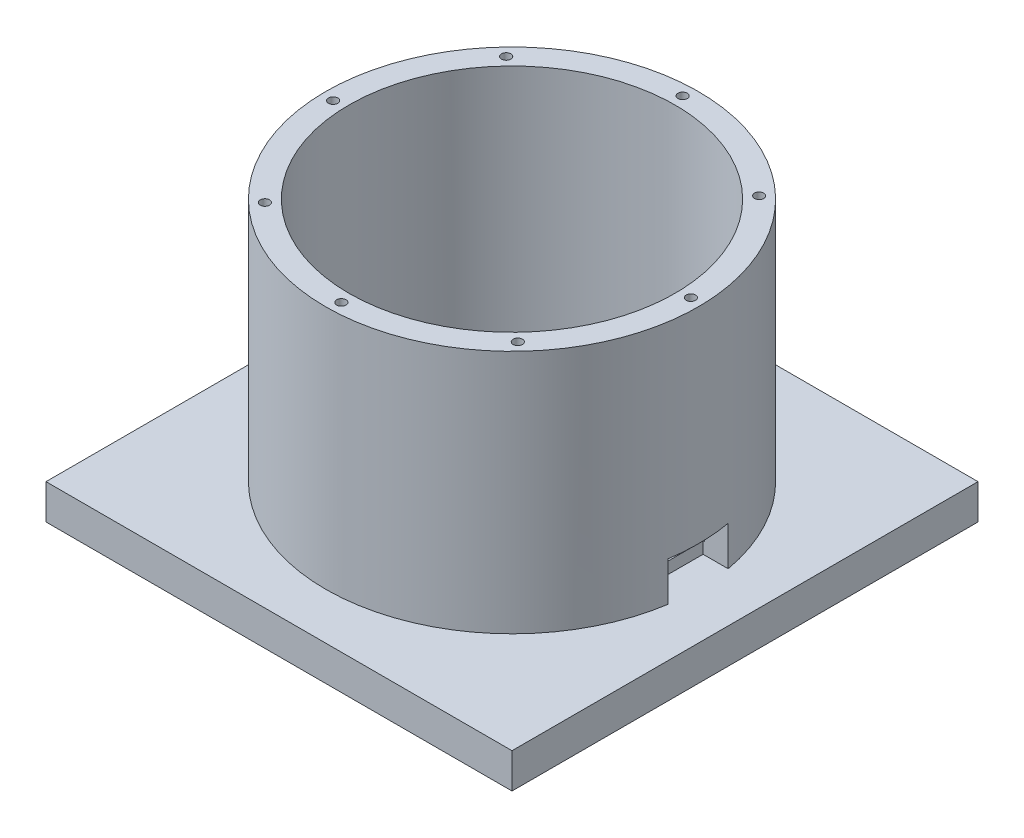
from build123d import *

# Parameters (mm, degrees)
CROQUIS1_R              = 80
SALIENTE_EXTRUIR1_DEPTH = 5
CROQUIS2_R              = 80
CROQUIS2_R_2            = 70
SALIENTE_EXTRUIR2_DEPTH = 100
CROQUIS3_R              = 16.15
CROQUIS3_R_2            = 12.15
CROQUIS3_R_3            = 17.65
CROQUIS3_R_4            = 12.65
SALIENTE_EXTRUIR3_DEPTH = 8
SALIENTE_EXTRUIR4_DEPTH = 50
CROQUIS6_W              = 200
CROQUIS6_H              = 200
SALIENTE_EXTRUIR5_DEPTH = 15
CROQUIS8_W              = 26.192306131
CROQUIS8_H              = 16.90838964
CORTAR_EXTRUIR1_DEPTH   = 32
CROQUIS9_R              = 2
CORTAR_EXTRUIR2_DEPTH   = 10


with BuildPart() as part:
    # Croquis1 → Saliente-Extruir1 (new body)
    with BuildSketch(Plane(origin=(0, 0, 0), x_dir=(1, 0, 0), z_dir=(0, 1, 0))):
        with Locations(Location((0, 0, 0), (0, 0, 270))):
            Circle(CROQUIS1_R)
    extrude(amount=SALIENTE_EXTRUIR1_DEPTH)

    # Croquis2 → Saliente-Extruir2 (add)
    with BuildSketch(Plane(origin=(0, 5, 0), x_dir=(1, 0, 0), z_dir=(0, 1, 0))):
        with Locations(Location((0, 0, 0), (0, 0, 270))):
            Circle(CROQUIS2_R)
        with Locations(Location((0, 0, 0), (0, 0, 270))):
            Circle(CROQUIS2_R_2, mode=Mode.SUBTRACT)
    extrude(amount=SALIENTE_EXTRUIR2_DEPTH)

    # Croquis3 → Saliente-Extruir3 (add)
    # profile 1 of 2: a face of its own
    with BuildSketch(Plane(origin=(0, 5, 0), x_dir=(1, 0, 0), z_dir=(0, 1, 0))):
        with Locations(Location((0, 0, 0), (0, 0, 270))):
            Circle(CROQUIS3_R)
        with Locations(Location((0, 0, 0), (0, 0, 270))):
            Circle(CROQUIS3_R_2, mode=Mode.SUBTRACT)
    # profile 2 of 2: a face of its own
    with BuildSketch(Plane(origin=(0, 5, 0), x_dir=(1, 0, 0), z_dir=(0, 1, 0))):
        with Locations(Location((40, 0, 0), (0, 0, 270))):
            Circle(CROQUIS3_R_3)
        with Locations(Location((40, 0, 0), (0, 0, 270))):
            Circle(CROQUIS3_R_4, mode=Mode.SUBTRACT)
    extrude(amount=SALIENTE_EXTRUIR3_DEPTH)

    # Croquis5 → Saliente-Extruir4 (add)
    with BuildSketch(Plane(origin=(0, 13, 0), x_dir=(1, 0, 0), z_dir=(0, 1, 0))):
        with BuildLine():
            Line((50.235999238, 7.432820433), (56.008612695, 7.432820433))
            ThreePointArc((56.008612695, 7.432820433), (22.356299399, -0.471517861), (56.38275473, -6.567179567))
            Line((56.38275473, -6.567179567), (50.811783041, -6.567179567))
            ThreePointArc((50.811783041, -6.567179567), (27.360684958, -0.519822349), (50.235999238, 7.432820433))
        make_face()
    extrude(amount=SALIENTE_EXTRUIR4_DEPTH)

    # Croquis6 → Saliente-Extruir5 (add)
    with BuildSketch(Plane.XZ):
        Rectangle(CROQUIS6_W, CROQUIS6_H)
    extrude(amount=SALIENTE_EXTRUIR5_DEPTH)

    # Croquis8 → Cortar-Extruir1 (cut)
    with BuildSketch(Plane(origin=(100, 0, 0), x_dir=(0, 0, -1), z_dir=(1, 0, 0))):
        with Locations((0.906775278, 8.45419482)):
            Rectangle(CROQUIS8_W, CROQUIS8_H)
    extrude(amount=-CORTAR_EXTRUIR1_DEPTH, mode=Mode.SUBTRACT)

    # Croquis9 → Cortar-Extruir2 (cut)
    with BuildSketch(Plane(origin=(0, 105, 0), x_dir=(1, 0, 0), z_dir=(0, 1, 0))):
        with Locations(Location((-54.281139298, 51.78487788, 0), (0, 0, 270))):
            Circle(CROQUIS9_R)
        with Locations(Location((-1.765123376, 75, 0), (0, 0, 270))):
            Circle(CROQUIS9_R)
        with Locations(Location((-51.78487788, -54.281139298, 0), (0, 0, 270))):
            Circle(CROQUIS9_R)
        with Locations(Location((75, 1.765123376, 0), (0, 0, 270))):
            Circle(CROQUIS9_R)
        with Locations(Location((-75, -1.765123376, 0), (0, 0, 270))):
            Circle(CROQUIS9_R)
        with Locations(Location((1.765123376, -75, 0), (0, 0, 270))):
            Circle(CROQUIS9_R)
        with Locations(Location((54.281139298, -51.78487788, 0), (0, 0, 270))):
            Circle(CROQUIS9_R)
        with Locations(Location((51.78487788, 54.281139298, 0), (0, 0, 270))):
            Circle(CROQUIS9_R)
    extrude(amount=-CORTAR_EXTRUIR2_DEPTH, mode=Mode.SUBTRACT)


solid = part.part
